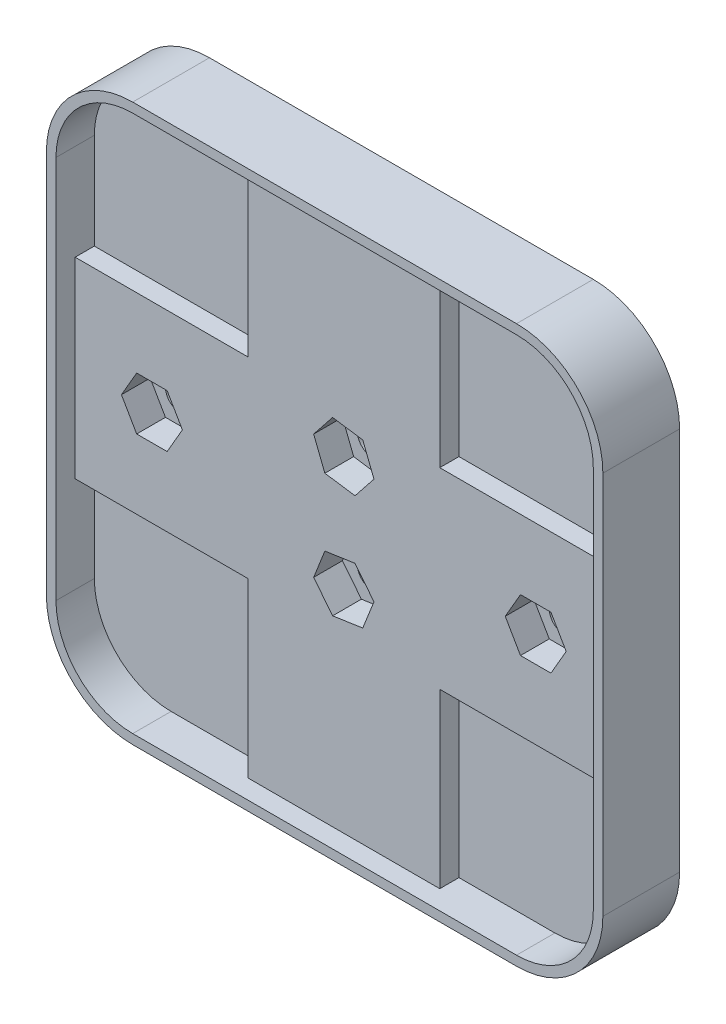
from build123d import *

# Parameters (mm, degrees)
EXTRUDE_1_DEPTH     = 4
EXTRUDE_START       = 2
EXTRUDE_2_DEPTH     = 2
EXTRUDE_3_DEPTH     = 2
SKETCH_4_R          = 1.6
CUT_EXTRUDE_1_DEPTH = 10
CUT_EXTRUDE_2_DEPTH = 3


with BuildPart() as part:
    # 草图1 → 凸台-拉伸1 (new body)
    with BuildSketch(Plane.XY):
        with BuildLine():
            Line((-35.40625, 64.537081934), (4.59375, 64.537081934))
            ThreePointArc((4.59375, 64.537081934), (10.957711031, 61.901042965), (13.59375, 55.537081934))
            Line((13.59375, 55.537081934), (13.59375, 15.537081934))
            ThreePointArc((13.59375, 15.537081934), (10.957711031, 9.173120903), (4.59375, 6.537081934))
            Line((4.59375, 6.537081934), (-35.40625, 6.537081934))
            ThreePointArc((-35.40625, 6.537081934), (-41.770211031, 9.173120903), (-44.40625, 15.537081934))
            Line((-44.40625, 15.537081934), (-44.40625, 55.537081934))
            ThreePointArc((-44.40625, 55.537081934), (-41.770211031, 61.901042965), (-35.40625, 64.537081934))
        make_face()
    extrude(amount=-EXTRUDE_1_DEPTH)

    # 草图2 → 凸台-拉伸2 (add)
    with BuildSketch(Plane.XY.offset(EXTRUDE_START)):
        with BuildLine():
            Line((13.59375, 15.537081934), (13.59375, 55.537081934))
            ThreePointArc((13.59375, 55.537081934), (10.957711031, 61.901042965), (4.59375, 64.537081934))
            Line((4.59375, 64.537081934), (-35.40625, 64.537081934))
            ThreePointArc((-35.40625, 64.537081934), (-41.770211031, 61.901042965), (-44.40625, 55.537081934))
            Line((-44.40625, 55.537081934), (-44.40625, 15.537081934))
            ThreePointArc((-44.40625, 15.537081934), (-41.770211031, 9.173120903), (-35.40625, 6.537081934))
            Line((-35.40625, 6.537081934), (4.59375, 6.537081934))
            ThreePointArc((4.59375, 6.537081934), (10.957711031, 9.173120903), (13.59375, 15.537081934))
        make_face()
        with BuildLine():
            Line((-35.40625, 63.537081934), (-25.40625, 63.537081934))
            Line((-25.40625, 63.537081934), (-25.40625, 45.537081934))
            Line((-25.40625, 45.537081934), (-43.40625, 45.537081934))
            Line((-43.40625, 45.537081934), (-43.40625, 55.537081934))
            ThreePointArc((-43.40625, 55.537081934), (-41.063104249, 61.193936184), (-35.40625, 63.537081934))
        make_face(mode=Mode.SUBTRACT)
        with BuildLine():
            Line((12.59375, 55.537081934), (12.59375, 45.537081934))
            Line((12.59375, 45.537081934), (-5.40625, 45.537081934))
            Line((-5.40625, 45.537081934), (-5.40625, 63.537081934))
            Line((-5.40625, 63.537081934), (4.59375, 63.537081934))
            ThreePointArc((4.59375, 63.537081934), (10.250604249, 61.193936184), (12.59375, 55.537081934))
        make_face(mode=Mode.SUBTRACT)
        with BuildLine():
            Line((-35.40625, 7.537081934), (-25.40625, 7.537081934))
            Line((-25.40625, 7.537081934), (-25.40625, 25.537081934))
            Line((-25.40625, 25.537081934), (-43.40625, 25.537081934))
            Line((-43.40625, 25.537081934), (-43.40625, 15.537081934))
            ThreePointArc((-43.40625, 15.537081934), (-41.063104249, 9.880227685), (-35.40625, 7.537081934))
        make_face(mode=Mode.SUBTRACT)
        with BuildLine():
            Line((-5.40625, 25.537081934), (12.59375, 25.537081934))
            Line((12.59375, 25.537081934), (12.59375, 15.537081934))
            ThreePointArc((12.59375, 15.537081934), (10.250604249, 9.880227685), (4.59375, 7.537081934))
            Line((4.59375, 7.537081934), (-5.40625, 7.537081934))
            Line((-5.40625, 7.537081934), (-5.40625, 25.537081934))
        make_face(mode=Mode.SUBTRACT)
    extrude(amount=-EXTRUDE_2_DEPTH)

    # 草图3 → 凸台-拉伸3 (add)
    with BuildSketch(Plane.XY.offset(2).offset(EXTRUDE_START)):
        with BuildLine():
            Line((13.59375, 15.537081934), (13.59375, 55.537081934))
            ThreePointArc((13.59375, 55.537081934), (10.957711031, 61.901042965), (4.59375, 64.537081934))
            Line((4.59375, 64.537081934), (-35.40625, 64.537081934))
            ThreePointArc((-35.40625, 64.537081934), (-41.770211031, 61.901042965), (-44.40625, 55.537081934))
            Line((-44.40625, 55.537081934), (-44.40625, 15.537081934))
            ThreePointArc((-44.40625, 15.537081934), (-41.770211031, 9.173120903), (-35.40625, 6.537081934))
            Line((-35.40625, 6.537081934), (4.59375, 6.537081934))
            ThreePointArc((4.59375, 6.537081934), (10.957711031, 9.173120903), (13.59375, 15.537081934))
        make_face()
        with BuildLine():
            Line((-43.40625, 55.537081934), (-43.40625, 45.537081934))
            Line((-43.40625, 45.537081934), (-43.40625, 25.537081934))
            Line((-43.40625, 25.537081934), (-43.40625, 15.537081934))
            ThreePointArc((-43.40625, 15.537081934), (-41.063104249, 9.880227685), (-35.40625, 7.537081934))
            Line((-35.40625, 7.537081934), (-25.40625, 7.537081934))
            Line((-25.40625, 7.537081934), (-5.40625, 7.537081934))
            Line((-5.40625, 7.537081934), (4.59375, 7.537081934))
            ThreePointArc((4.59375, 7.537081934), (10.250604249, 9.880227685), (12.59375, 15.537081934))
            Line((12.59375, 15.537081934), (12.59375, 25.537081934))
            Line((12.59375, 25.537081934), (12.59375, 45.537081934))
            Line((12.59375, 45.537081934), (12.59375, 55.537081934))
            ThreePointArc((12.59375, 55.537081934), (10.250604249, 61.193936184), (4.59375, 63.537081934))
            Line((4.59375, 63.537081934), (-5.40625, 63.537081934))
            Line((-5.40625, 63.537081934), (-25.40625, 63.537081934))
            Line((-25.40625, 63.537081934), (-35.40625, 63.537081934))
            ThreePointArc((-35.40625, 63.537081934), (-41.063104249, 61.193936184), (-43.40625, 55.537081934))
        make_face(mode=Mode.SUBTRACT)
    extrude(amount=-EXTRUDE_3_DEPTH)

    # 草图4 → 切除-拉伸1 (cut)
    with BuildSketch(Plane.XY.offset(2)):
        with Locations((-15.40625, 41.537081934)):
            Circle(SKETCH_4_R)
        with Locations((-15.40625, 29.537081934)):
            Circle(SKETCH_4_R)
        with Locations((4.59375, 35.537081934)):
            Circle(SKETCH_4_R)
        with Locations((-35.40625, 35.537081934)):
            Circle(SKETCH_4_R)
    extrude(amount=-CUT_EXTRUDE_1_DEPTH, mode=Mode.SUBTRACT)

    # 草图5 → 切除-拉伸2 (cut)
    with BuildSketch(Plane.XY.offset(2)):
        Polygon((-13.431907117, 44.024108978), (-16.572907158, 44.490426548), (-18.547250041, 42.003399505), (-17.380592883, 39.050054891), (-14.239592842, 38.58373732), (-12.265249959, 41.070764364), align=None)
        Polygon((1.418323519, 35.537081934), (3.00603676, 32.787081934), (6.18146324, 32.787081934), (7.769176481, 35.537081934), (6.18146324, 38.287081934), (3.00603676, 38.287081934), align=None)
        Polygon((-13.431907117, 27.050054891), (-12.265249959, 30.003399505), (-14.239592842, 32.490426548), (-17.380592883, 32.024108978), (-18.547250041, 29.070764364), (-16.572907158, 26.58373732), align=None)
        Polygon((-32.230823519, 35.537081934), (-33.81853676, 38.287081934), (-36.99396324, 38.287081934), (-38.581676481, 35.537081934), (-36.99396324, 32.787081934), (-33.81853676, 32.787081934), align=None)
    extrude(amount=-CUT_EXTRUDE_2_DEPTH, mode=Mode.SUBTRACT)


solid = part.part
